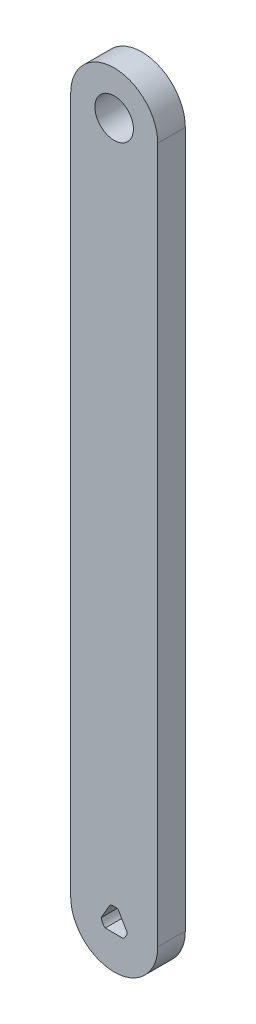
from build123d import *

# Parameters (mm, degrees)
ESBO_O1_R                = 3.325
RESSALTO_EXTRUS_O1_DEPTH = 4.7625


with BuildPart() as part:
    # Esboço1 → Ressalto-extrusão1 (new body)
    with BuildSketch(Plane.XY):
        with BuildLine():
            Line((-7.5, 0), (-7.5, 120))
            ThreePointArc((-7.5, 120), (0, 127.5), (7.5, 120))
            Line((7.5, 120), (7.5, 0))
            ThreePointArc((7.5, 0), (0, -7.5), (-7.5, 0))
        make_face()
        with Locations(Location((0, 120, 0), (0, 0, 180))):
            Circle(ESBO_O1_R, mode=Mode.SUBTRACT)
        with BuildLine():
            Line((2.246839856, -0.491640786), (0.697646517, 2.191640786))
            ThreePointArc((0.697646517, 2.191640786), (0, 2.3), (-0.697646517, 2.191640786))
            Line((-0.697646517, 2.191640786), (-2.246839856, -0.491640786))
            ThreePointArc((-2.246839856, -0.491640786), (-1.991858429, -1.15), (-1.549193338, -1.7))
            Line((-1.549193338, -1.7), (1.549193338, -1.7))
            ThreePointArc((1.549193338, -1.7), (1.991858429, -1.15), (2.246839856, -0.491640786))
        make_face(mode=Mode.SUBTRACT)
    extrude(amount=RESSALTO_EXTRUS_O1_DEPTH)


solid = part.part
